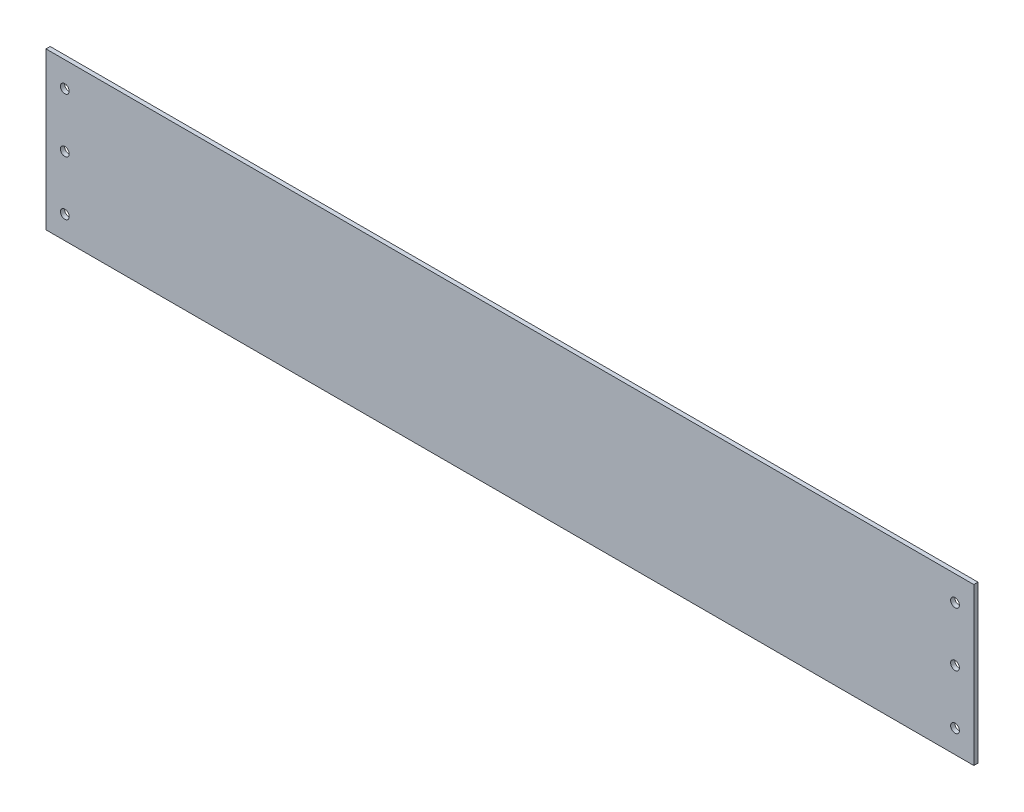
from build123d import *

# Parameters (mm, degrees)
SKETCH_1_W      = 222
SKETCH_1_H      = 37.5
SKETCH_1_R      = 1.05
EXTRUDE_1_DEPTH = 1


with BuildPart() as part:
    # Эскиз1 → Бобышка-Вытянуть1 (new body)
    with BuildSketch(Plane.XY):
        with Locations((111, 18.75)):
            Rectangle(SKETCH_1_W, SKETCH_1_H)
        with Locations((4.5, 31.5)):
            Circle(SKETCH_1_R, mode=Mode.SUBTRACT)
        with Locations((4.5, 18.5)):
            Circle(SKETCH_1_R, mode=Mode.SUBTRACT)
        with Locations((4.5, 5.5)):
            Circle(SKETCH_1_R, mode=Mode.SUBTRACT)
        with Locations(Location((217.5, 5.5, 0), (0, 0, 180))):
            Circle(SKETCH_1_R, mode=Mode.SUBTRACT)
        with Locations(Location((217.5, 18.5, 0), (0, 0, 180))):
            Circle(SKETCH_1_R, mode=Mode.SUBTRACT)
        with Locations(Location((217.5, 31.5, 0), (0, 0, 180))):
            Circle(SKETCH_1_R, mode=Mode.SUBTRACT)
    extrude(amount=EXTRUDE_1_DEPTH)


solid = part.part
